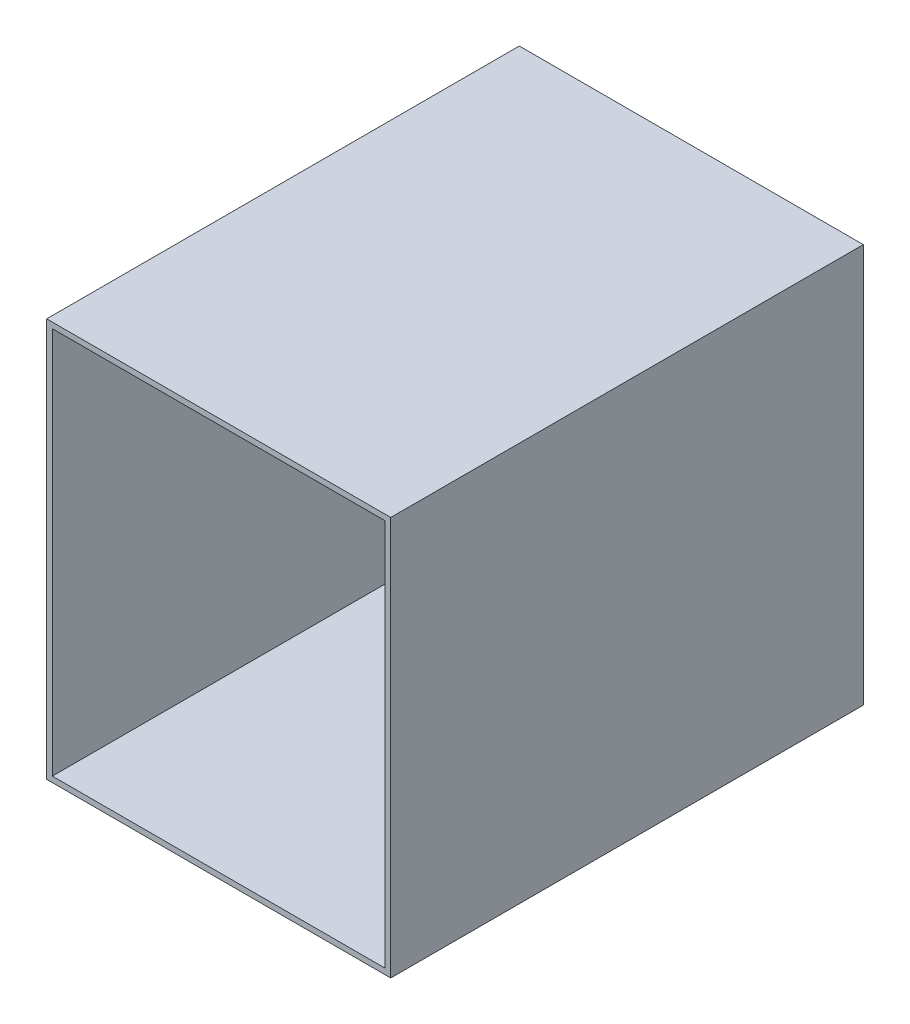
from build123d import *

# Parameters (mm, degrees)
SKETCH_1_W         = 182
SKETCH_1_H         = 211
BLOCKEXTRUDE_DEPTH = 250
SHELL_1_T          = -3


with BuildPart() as part:
    # 草图1 → BlockExtrude (new body)
    with BuildSketch(Plane.XY):
        with Locations((91, 105.5)):
            Rectangle(SKETCH_1_W, SKETCH_1_H)
    extrude(amount=BLOCKEXTRUDE_DEPTH)

    # 抽壳1
    shell_1_openings = [part.faces().sort_by_distance(p)[0] for p in [
        (91, 105.5, 250),
    ]]
    offset(amount=SHELL_1_T, openings=shell_1_openings, kind=Kind.INTERSECTION)


solid = part.part
